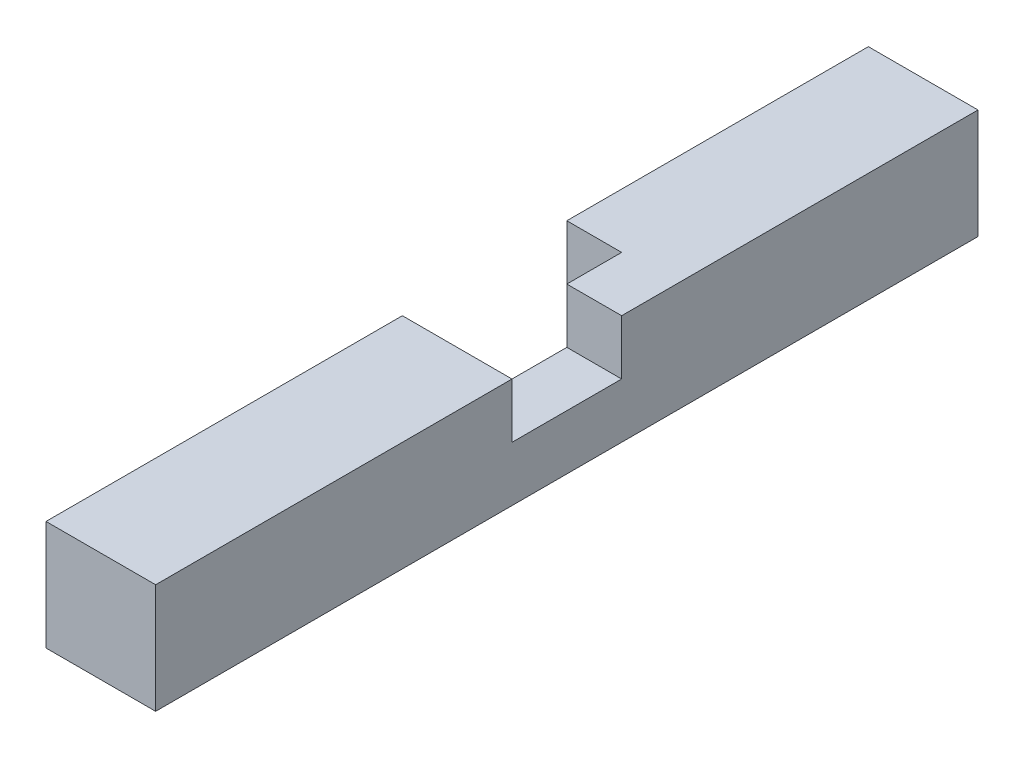
from build123d import *

# Parameters (mm, degrees)
SKETCH_1_W          = 4
SKETCH_1_H          = 4
EXTRUDE_1_DEPTH     = 30
SKETCH_3_W          = 2
SKETCH_3_H          = 4
CUT_EXTRUDE_1_DEPTH = 2
SKETCH_4_W          = 4
SKETCH_4_H          = 2
CUT_EXTRUDE_2_DEPTH = 4
SKETCH_5_W          = 2
SKETCH_5_H          = 2
CUT_EXTRUDE_3_DEPTH = 2


with BuildPart() as part:
    # 草圖1 → 填料-伸長1 (new body)
    with BuildSketch(Plane.XY):
        Rectangle(SKETCH_1_W, SKETCH_1_H)
    extrude(amount=EXTRUDE_1_DEPTH)

    # 草圖3 → 除料-伸長1 (cut)
    with BuildSketch(Plane.ZY.offset(2)):
        with Locations((12, 0)):
            Rectangle(SKETCH_3_W, SKETCH_3_H)
    extrude(amount=-CUT_EXTRUDE_1_DEPTH, mode=Mode.SUBTRACT)

    # 草圖4 → 除料-伸長2 (cut)
    with BuildSketch(Plane.ZY.offset(2)):
        with Locations((15, 1)):
            Rectangle(SKETCH_4_W, SKETCH_4_H)
    extrude(amount=-CUT_EXTRUDE_2_DEPTH, mode=Mode.SUBTRACT)

    # 草圖5 → 除料-伸長3 (cut)
    with BuildSketch(Plane.ZY.offset(2)):
        with Locations((14, -1)):
            Rectangle(SKETCH_5_W, SKETCH_5_H)
    extrude(amount=-CUT_EXTRUDE_3_DEPTH, mode=Mode.SUBTRACT)


solid = part.part
